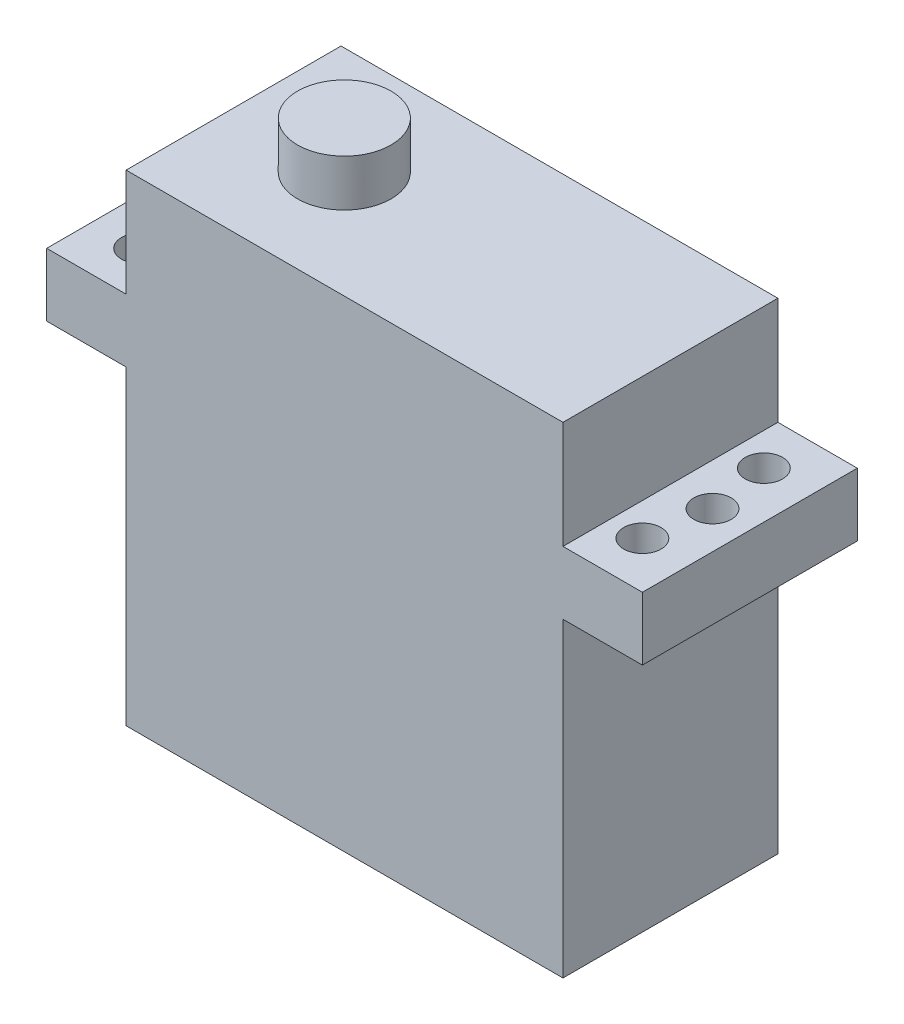
from build123d import *

# Parameters (mm, degrees)
BOSS_EXTRUDE1_DEPTH = 5.842
SKETCH2_R           = 2.54
BOSS_EXTRUDE2_DEPTH = 2.54
CUT_EXTRUDE1_REACH  = 37.14
SKETCH3_R           = 1.016


with BuildPart() as part:
    # Sketch1 → Boss-Extrude1 (new, symmetric)
    with BuildSketch(Plane.XY):
        Polygon((0, 0), (23.749, 0), (23.749, 16.891), (28.067, 16.891), (28.067, 20.32), (23.749, 20.32), (23.749, 26.162), (0, 26.162), (0, 20.32), (-4.318, 20.32), (-4.318, 16.891), (0, 16.891), align=None)
    extrude(amount=BOSS_EXTRUDE1_DEPTH, both=True)

    # Sketch2 → Boss-Extrude2 (add)
    with BuildSketch(Plane(origin=(0, 26.162, 0), x_dir=(1, 0, 0), z_dir=(0, 1, 0))):
        with Locations((6.0198, 0)):
            Circle(SKETCH2_R)
    extrude(amount=BOSS_EXTRUDE2_DEPTH)

    # Sketch3 → Cut-Extrude1 (cut, up to next)
    with BuildSketch(Plane(origin=(0, 20.32, 0), x_dir=(1, 0, 0), z_dir=(0, 1, 0)), mode=Mode.PRIVATE) as cut_extrude1_sk1:
        with Locations(Location((-2.286, 0, 0), (0, 0, 180))):
            Circle(SKETCH3_R)
    cut_extrude1_tool1 = extrude(cut_extrude1_sk1.sketch, amount=-CUT_EXTRUDE1_REACH, mode=Mode.PRIVATE) & part.part
    # Sketch3 → Cut-Extrude1 (cut, up to next)
    with BuildSketch(Plane(origin=(0, 20.32, 0), x_dir=(1, 0, 0), z_dir=(0, 1, 0)), mode=Mode.PRIVATE) as cut_extrude1_sk2:
        with Locations(Location((-1.778, 3.302, 0), (0, 0, 180))):
            Circle(SKETCH3_R)
    cut_extrude1_tool2 = extrude(cut_extrude1_sk2.sketch, amount=-CUT_EXTRUDE1_REACH, mode=Mode.PRIVATE) & part.part
    # Sketch3 → Cut-Extrude1 (cut, up to next)
    with BuildSketch(Plane(origin=(0, 20.32, 0), x_dir=(1, 0, 0), z_dir=(0, 1, 0)), mode=Mode.PRIVATE) as cut_extrude1_sk3:
        with Locations(Location((-1.778, -3.302, 0), (0, 0, 180))):
            Circle(SKETCH3_R)
    cut_extrude1_tool3 = extrude(cut_extrude1_sk3.sketch, amount=-CUT_EXTRUDE1_REACH, mode=Mode.PRIVATE) & part.part
    # Sketch3 → Cut-Extrude1 (cut, up to next)
    with BuildSketch(Plane(origin=(0, 20.32, 0), x_dir=(1, 0, 0), z_dir=(0, 1, 0)), mode=Mode.PRIVATE) as cut_extrude1_sk4:
        with Locations(Location((25.527, -3.302, 0), (0, 0, 180))):
            Circle(SKETCH3_R)
    cut_extrude1_tool4 = extrude(cut_extrude1_sk4.sketch, amount=-CUT_EXTRUDE1_REACH, mode=Mode.PRIVATE) & part.part
    # Sketch3 → Cut-Extrude1 (cut, up to next)
    with BuildSketch(Plane(origin=(0, 20.32, 0), x_dir=(1, 0, 0), z_dir=(0, 1, 0)), mode=Mode.PRIVATE) as cut_extrude1_sk5:
        with Locations(Location((26.035, 0, 0), (0, 0, 180))):
            Circle(SKETCH3_R)
    cut_extrude1_tool5 = extrude(cut_extrude1_sk5.sketch, amount=-CUT_EXTRUDE1_REACH, mode=Mode.PRIVATE) & part.part
    # Sketch3 → Cut-Extrude1 (cut, up to next)
    with BuildSketch(Plane(origin=(0, 20.32, 0), x_dir=(1, 0, 0), z_dir=(0, 1, 0)), mode=Mode.PRIVATE) as cut_extrude1_sk6:
        with Locations(Location((25.527, 3.302, 0), (0, 0, 180))):
            Circle(SKETCH3_R)
    cut_extrude1_tool6 = extrude(cut_extrude1_sk6.sketch, amount=-CUT_EXTRUDE1_REACH, mode=Mode.PRIVATE) & part.part
    add(cut_extrude1_tool1.solids().sort_by_distance((-2.286, 20.32, 0))[0], mode=Mode.SUBTRACT)
    add(cut_extrude1_tool2.solids().sort_by_distance((-1.778, 20.32, -3.302))[0], mode=Mode.SUBTRACT)
    add(cut_extrude1_tool3.solids().sort_by_distance((-1.778, 20.32, 3.302))[0], mode=Mode.SUBTRACT)
    add(cut_extrude1_tool4.solids().sort_by_distance((25.527, 20.32, 3.302))[0], mode=Mode.SUBTRACT)
    add(cut_extrude1_tool5.solids().sort_by_distance((26.035, 20.32, 0))[0], mode=Mode.SUBTRACT)
    add(cut_extrude1_tool6.solids().sort_by_distance((25.527, 20.32, -3.302))[0], mode=Mode.SUBTRACT)


solid = part.part
